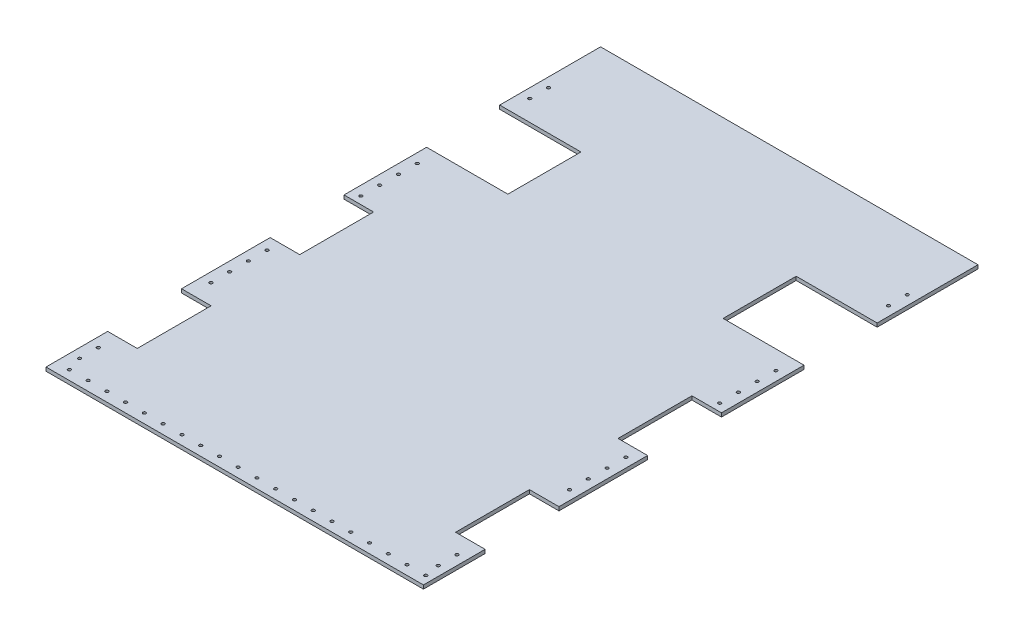
from build123d import *

# Parameters (mm, degrees)
CROQUIS1_W              = 511
CROQUIS1_H              = 705.8
SALIENTE_EXTRUIR1_DEPTH = 5
CROQUIS2_W              = 40
CROQUIS2_H              = 100
CORTAR_EXTRUIR1_DEPTH   = 10
CROQUIS4_W              = 110
CROQUIS4_H              = 98.950839499
CORTAR_EXTRUIR3_DEPTH   = 10
CROQUIS7_R              = 2.07
CORTAR_EXTRUIR6_DEPTH   = 10
CROQUIS8_R              = 2.07
CORTAR_EXTRUIR7_DEPTH   = 10
CROQUIS9_W              = 511
CROQUIS9_H              = 45
SALIENTE_EXTRUIR2_DEPTH = 5


with BuildPart() as part:
    # Croquis1 → Saliente-Extruir1 (new body)
    with BuildSketch(Plane(origin=(0, 0, 0), x_dir=(1, 0, 0), z_dir=(0, 1, 0))):
        Rectangle(CROQUIS1_W, CROQUIS1_H)
    extrude(amount=SALIENTE_EXTRUIR1_DEPTH)

    # Croquis2 → Cortar-Extruir1 (cut)
    with BuildSketch(Plane(origin=(0, 0, 0), x_dir=(-1, 0, 0), z_dir=(0, -1, 0))):
        with Locations((235.5, -219.401276077)):
            Rectangle(CROQUIS2_W, CROQUIS2_H)
        with Locations((-235.5, -219.401276077)):
            Rectangle(CROQUIS2_W, CROQUIS2_H)
        with Locations((235.5, 0.598723923)):
            Rectangle(CROQUIS2_W, CROQUIS2_H)
        with Locations((-235.5, 0.598723923)):
            Rectangle(CROQUIS2_W, CROQUIS2_H)
    extrude(amount=-CORTAR_EXTRUIR1_DEPTH, mode=Mode.SUBTRACT)

    # Croquis4 → Cortar-Extruir3 (cut)
    with BuildSketch(Plane(origin=(0, 0, 0), x_dir=(-1, 0, 0), z_dir=(0, -1, 0))):
        with Locations((200.5, 211.875419749)):
            Rectangle(CROQUIS4_W, CROQUIS4_H)
        with Locations((-200.9, 211.875419749)):
            Rectangle(CROQUIS4_W, CROQUIS4_H)
    extrude(amount=-CORTAR_EXTRUIR3_DEPTH, mode=Mode.SUBTRACT)

    # Croquis7 → Cortar-Extruir6 (cut)
    with BuildSketch(Plane(origin=(0, 0, 0), x_dir=(-1, 0, 0), z_dir=(0, -1, 0))):
        with Locations(Location((236.6, -340.2, 0), (0, 0, 90))):
            Circle(CROQUIS7_R)
        with Locations(Location((211.2, -340.2, 0), (0, 0, 90))):
            Circle(CROQUIS7_R)
        with Locations(Location((185.8, -340.2, 0), (0, 0, 90))):
            Circle(CROQUIS7_R)
        with Locations(Location((160.4, -340.2, 0), (0, 0, 90))):
            Circle(CROQUIS7_R)
        with Locations(Location((135, -340.2, 0), (0, 0, 90))):
            Circle(CROQUIS7_R)
        with Locations(Location((109.6, -340.2, 0), (0, 0, 90))):
            Circle(CROQUIS7_R)
        with Locations(Location((84.2, -340.2, 0), (0, 0, 90))):
            Circle(CROQUIS7_R)
        with Locations(Location((58.8, -340.2, 0), (0, 0, 90))):
            Circle(CROQUIS7_R)
        with Locations(Location((33.4, -340.2, 0), (0, 0, 90))):
            Circle(CROQUIS7_R)
        with Locations(Location((8, -340.2, 0), (0, 0, 90))):
            Circle(CROQUIS7_R)
        with Locations(Location((-17.4, -340.2, 0), (0, 0, 90))):
            Circle(CROQUIS7_R)
        with Locations(Location((-42.8, -340.2, 0), (0, 0, 90))):
            Circle(CROQUIS7_R)
        with Locations(Location((-68.2, -340.2, 0), (0, 0, 90))):
            Circle(CROQUIS7_R)
        with Locations(Location((-93.6, -340.2, 0), (0, 0, 90))):
            Circle(CROQUIS7_R)
        with Locations(Location((-119, -340.2, 0), (0, 0, 90))):
            Circle(CROQUIS7_R)
        with Locations(Location((-144.4, -340.2, 0), (0, 0, 90))):
            Circle(CROQUIS7_R)
        with Locations(Location((-169.8, -340.2, 0), (0, 0, 90))):
            Circle(CROQUIS7_R)
        with Locations(Location((-195.2, -340.2, 0), (0, 0, 90))):
            Circle(CROQUIS7_R)
        with Locations(Location((-220.6, -340.2, 0), (0, 0, 90))):
            Circle(CROQUIS7_R)
        with Locations(Location((-246, -340.2, 0), (0, 0, 90))):
            Circle(CROQUIS7_R)
        with Locations(Location((242.8, -320.2, 0), (0, 0, 90))):
            Circle(CROQUIS7_R)
        with Locations(Location((242.8, -294.8, 0), (0, 0, 90))):
            Circle(CROQUIS7_R)
        with Locations(Location((242.8, -142.4, 0), (0, 0, 90))):
            Circle(CROQUIS7_R)
        with Locations(Location((242.8, -117, 0), (0, 0, 90))):
            Circle(CROQUIS7_R)
        with Locations(Location((242.8, -91.6, 0), (0, 0, 90))):
            Circle(CROQUIS7_R)
        with Locations(Location((242.8, -66.2, 0), (0, 0, 90))):
            Circle(CROQUIS7_R)
        with Locations(Location((242.8, 60.8, 0), (0, 0, 90))):
            Circle(CROQUIS7_R)
        with Locations(Location((242.8, 86.2, 0), (0, 0, 90))):
            Circle(CROQUIS7_R)
        with Locations(Location((242.8, 111.6, 0), (0, 0, 90))):
            Circle(CROQUIS7_R)
        with Locations(Location((242.8, 137, 0), (0, 0, 90))):
            Circle(CROQUIS7_R)
        with Locations(Location((242.8, 289.4, 0), (0, 0, 90))):
            Circle(CROQUIS7_R)
        with Locations(Location((242.8, 314.8, 0), (0, 0, 90))):
            Circle(CROQUIS7_R)
    extrude(amount=-CORTAR_EXTRUIR6_DEPTH, mode=Mode.SUBTRACT)

    # Croquis8 → Cortar-Extruir7 (cut)
    with BuildSketch(Plane(origin=(0, 0, 0), x_dir=(-1, 0, 0), z_dir=(0, -1, 0))):
        with Locations((246, 385.2)):
            Circle(CROQUIS8_R)
        with Locations((220.6, 385.2)):
            Circle(CROQUIS8_R)
        with Locations((195.2, 385.2)):
            Circle(CROQUIS8_R)
        with Locations((169.8, 385.2)):
            Circle(CROQUIS8_R)
        with Locations((144.4, 385.2)):
            Circle(CROQUIS8_R)
        with Locations((119, 385.2)):
            Circle(CROQUIS8_R)
        with Locations((93.6, 385.2)):
            Circle(CROQUIS8_R)
        with Locations((68.2, 385.2)):
            Circle(CROQUIS8_R)
        with Locations((42.8, 385.2)):
            Circle(CROQUIS8_R)
        with Locations((17.4, 385.2)):
            Circle(CROQUIS8_R)
        with Locations((-8, 385.2)):
            Circle(CROQUIS8_R)
        with Locations((-33.4, 385.2)):
            Circle(CROQUIS8_R)
        with Locations((-58.8, 385.2)):
            Circle(CROQUIS8_R)
        with Locations((-84.2, 385.2)):
            Circle(CROQUIS8_R)
        with Locations((-109.6, 385.2)):
            Circle(CROQUIS8_R)
        with Locations((-135, 385.2)):
            Circle(CROQUIS8_R)
        with Locations((-160.4, 385.2)):
            Circle(CROQUIS8_R)
        with Locations((-185.8, 385.2)):
            Circle(CROQUIS8_R)
        with Locations((-211.2, 385.2)):
            Circle(CROQUIS8_R)
        with Locations((-236.6, 385.2)):
            Circle(CROQUIS8_R)
        with Locations(Location((-242.8, 314.8, 0), (0, 0, 90))):
            Circle(CROQUIS8_R)
        with Locations(Location((-242.8, 289.4, 0), (0, 0, 90))):
            Circle(CROQUIS8_R)
        with Locations(Location((-242.8, 137, 0), (0, 0, 90))):
            Circle(CROQUIS8_R)
        with Locations(Location((-242.8, 111.6, 0), (0, 0, 90))):
            Circle(CROQUIS8_R)
        with Locations(Location((-242.8, 86.2, 0), (0, 0, 90))):
            Circle(CROQUIS8_R)
        with Locations(Location((-242.8, 60.8, 0), (0, 0, 90))):
            Circle(CROQUIS8_R)
        with Locations(Location((-242.8, -66.2, 0), (0, 0, 90))):
            Circle(CROQUIS8_R)
        with Locations(Location((-242.8, -91.6, 0), (0, 0, 90))):
            Circle(CROQUIS8_R)
        with Locations(Location((-242.8, -117, 0), (0, 0, 90))):
            Circle(CROQUIS8_R)
        with Locations(Location((-242.8, -142.4, 0), (0, 0, 90))):
            Circle(CROQUIS8_R)
        with Locations(Location((-242.8, -294.8, 0), (0, 0, 90))):
            Circle(CROQUIS8_R)
        with Locations(Location((-242.8, -320.2, 0), (0, 0, 90))):
            Circle(CROQUIS8_R)
    extrude(amount=-CORTAR_EXTRUIR7_DEPTH, mode=Mode.SUBTRACT)

    # Croquis9 → Saliente-Extruir2 (add)
    with BuildSketch(Plane(origin=(0, 5, 0), x_dir=(1, 0, 0), z_dir=(0, 1, 0))):
        with Locations((0, 375.4)):
            Rectangle(CROQUIS9_W, CROQUIS9_H)
    extrude(amount=-SALIENTE_EXTRUIR2_DEPTH)


solid = part.part
